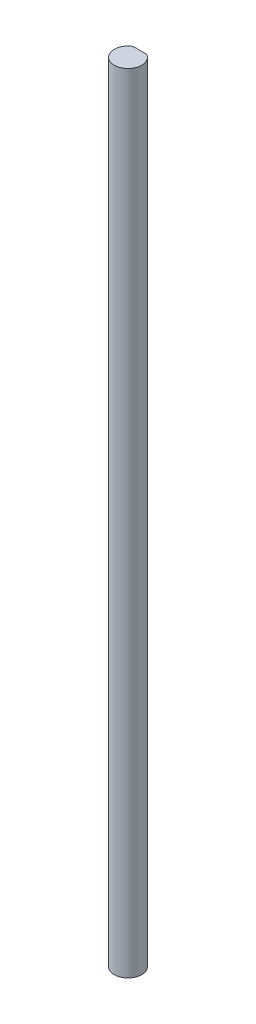
from build123d import *

# Parameters (mm, degrees)
BOSS_EXTRUDE1_DEPTH = 181.5


with BuildPart() as part:
    # Sketch1 → Boss-Extrude1 (new body)
    with BuildSketch(Plane(origin=(0, 0, 0), x_dir=(1, 0, 0), z_dir=(0, 1, 0))):
        with BuildLine():
            Line((-1.5875, 2.749630657), (1.5875, 2.749630657))
            ThreePointArc((1.5875, 2.749630657), (0, -3.175), (-1.5875, 2.749630657))
        make_face()
    extrude(amount=BOSS_EXTRUDE1_DEPTH)


solid = part.part
